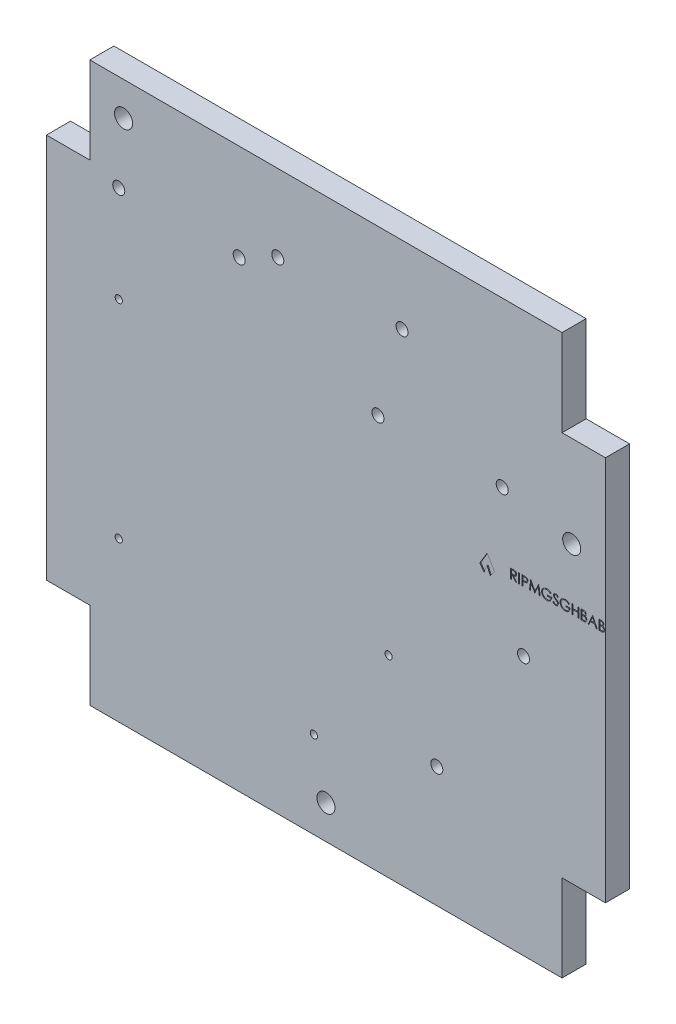
from build123d import *

# Parameters (mm, degrees)
SZKIC2_R                    = 0.75
SZKIC2_R_2                  = 1.875
SZKIC2_R_3                  = 1.25
DODANIE_WYCI_GNI_CIE1_DEPTH = 5
SZKIC4_W                    = 0.179487179
SZKIC4_H                    = 2
WYTNIJ_WYCI_GNI_CIE1_DEPTH  = 0.2


with BuildPart() as part:
    # Szkic2 → Dodanie-wyciągnięcie1 (new body)
    with BuildSketch(Plane.XY):
        Polygon((9, 18), (9, 0), (107, 0), (107, 18), (116, 18), (116, 98), (107, 98), (107, 116), (9, 116), (9, 98), (0, 98), (0, 18), align=None)
        with Locations((55.5, 18)):
            Circle(SZKIC2_R, mode=Mode.SUBTRACT)
        with Locations((15, 33)):
            Circle(SZKIC2_R, mode=Mode.SUBTRACT)
        with Locations((58, 7)):
            Circle(SZKIC2_R_2, mode=Mode.SUBTRACT)
        with Locations((81, 25)):
            Circle(SZKIC2_R_3, mode=Mode.SUBTRACT)
        with Locations((71, 40)):
            Circle(SZKIC2_R, mode=Mode.SUBTRACT)
        with Locations((99, 53.844410204)):
            Circle(SZKIC2_R_3, mode=Mode.SUBTRACT)
        with Locations((15, 76)):
            Circle(SZKIC2_R, mode=Mode.SUBTRACT)
        with Locations((15, 96)):
            Circle(SZKIC2_R_3, mode=Mode.SUBTRACT)
        with Locations((16, 109)):
            Circle(SZKIC2_R_2, mode=Mode.SUBTRACT)
        with Locations((40, 96)):
            Circle(SZKIC2_R_3, mode=Mode.SUBTRACT)
        with Locations((48, 100)):
            Circle(SZKIC2_R_3, mode=Mode.SUBTRACT)
        with Locations((68.790622886, 82)):
            Circle(SZKIC2_R_3, mode=Mode.SUBTRACT)
        with Locations((94.581245773, 82)):
            Circle(SZKIC2_R_3, mode=Mode.SUBTRACT)
        with Locations((109, 79)):
            Circle(SZKIC2_R_2, mode=Mode.SUBTRACT)
        with Locations((73.790622886, 100)):
            Circle(SZKIC2_R_3, mode=Mode.SUBTRACT)
    extrude(amount=DODANIE_WYCI_GNI_CIE1_DEPTH)

    # Szkic4 → Wytnij-wyciągnięcie1 (cut)
    # profile 1 of 12: a face of its own
    with BuildSketch(Plane.XY.offset(5)):
        Polygon((91.452642127, 66.344356395), (90.815929903, 64.844356395), (89.913207368, 66.04230966), (91.452642127, 68.581213421), (92.992076886, 66.04230966), (92.089354351, 64.844356395), align=None)
    # profile 2 of 12: a face of its own
    with BuildSketch(Plane.XY.offset(5)):
        with BuildLine():
            Line((114.666666667, 68.344356395), (115.056891026, 68.344356395))
            add(Edge.make_bspline(
                [(115.056891026, 68.344356395), (115.075993013, 68.344255967), (115.113017419, 68.344061311), (115.1668571, 68.341042378), (115.217284992, 68.336925996), (115.264315719, 68.330394514), (115.307927549, 68.322513499), (115.348251913, 68.312969604), (115.385160583, 68.301525824), (115.429225004, 68.28332795), (115.479465381, 68.256286139), (115.533864463, 68.216326959), (115.580381171, 68.167451266), (115.620487638, 68.11231832), (115.652373992, 68.051669307), (115.675442162, 67.986949771), (115.690046662, 67.91899449), (115.691548625, 67.872341245), (115.692307692, 67.848763447)],
                knots=[0, 0, 0, 0, 1.001505555, 1.941167018, 2.826882275, 3.653841531, 4.429895133, 5.150066043, 5.825578002, 6.45369114, 7.647487171, 8.808567382, 9.977351308, 11.170798116, 12.373658725, 13.556498008, 14.765093433, 16, 16, 16, 16], degree=3))
            add(Edge.make_bspline(
                [(115.692307692, 67.848763447), (115.691682996, 67.826676272), (115.690455409, 67.783272891), (115.678716689, 67.719790543), (115.660339165, 67.659361275), (115.634793308, 67.602205626), (115.601592167, 67.54961499), (115.562244557, 67.501165124), (115.514772098, 67.458907377), (115.479204532, 67.435282861), (115.461137821, 67.423282677)],
                knots=[0, 0, 0, 0, 1.044552857, 2.05264487, 3.044412934, 4.028983338, 5.005914585, 5.980388656, 6.974128949, 8, 8, 8, 8], degree=3))
            add(Edge.make_bspline(
                [(115.461137821, 67.423282677), (115.483858065, 67.414559821), (115.52732752, 67.397870835), (115.587148099, 67.368364856), (115.63868801, 67.336272222), (115.682343522, 67.30122545), (115.719679325, 67.263448987), (115.752281006, 67.222388921), (115.780098934, 67.177509631), (115.803934891, 67.12927904), (115.82253418, 67.078189629), (115.836463268, 67.024720614), (115.844444667, 66.969063726), (115.845580462, 66.931186366), (115.846153846, 66.912064729)],
                knots=[0, 0, 0, 0, 1.27268992, 2.434971085, 3.483601985, 4.442670788, 5.356604649, 6.2567628, 7.179492994, 8.113709626, 9.066344395, 10.018646069, 10.999752585, 12, 12, 12, 12], degree=3))
            add(Edge.make_bspline(
                [(115.846153846, 66.912064729), (115.845595648, 66.892540802), (115.844497379, 66.854126929), (115.836394538, 66.797695423), (115.822675048, 66.743766882), (115.80377725, 66.691992492), (115.77911307, 66.642472415), (115.749097091, 66.59515055), (115.713307626, 66.550502361), (115.673271701, 66.508031719), (115.627979046, 66.469844412), (115.5791129, 66.435835437), (115.52605786, 66.407866259), (115.469685292, 66.384371389), (115.409362826, 66.366424419), (115.345361336, 66.353868662), (115.277736021, 66.345408641), (115.231330449, 66.344713095), (115.207532051, 66.344356395)],
                knots=[0, 0, 0, 0, 0.978564426, 1.925352924, 2.850884081, 3.763762016, 4.682927383, 5.618979971, 6.567305752, 7.547517671, 8.540179244, 9.531824382, 10.526200242, 11.540722885, 12.589160233, 13.674978461, 14.80764778, 16, 16, 16, 16], degree=3))
            Line((115.207532051, 66.344356395), (114.666666667, 66.344356395))
            Line((114.666666667, 66.344356395), (114.666666667, 68.344356395))
        make_face()
        with BuildLine():
            Line((114.846153846, 68.13922819), (114.846153846, 67.498202549))
            Line((114.846153846, 67.498202549), (114.966746795, 67.498202549))
            add(Edge.make_bspline(
                [(114.966746795, 67.498202549), (114.984374678, 67.498431077), (115.01843534, 67.498872638), (115.067760996, 67.500137505), (115.11354672, 67.503679244), (115.155713482, 67.507219965), (115.194194879, 67.512976873), (115.228905657, 67.519829514), (115.260390569, 67.527076889), (115.296698881, 67.53940231), (115.337883423, 67.557618124), (115.381788054, 67.585887745), (115.420493465, 67.619558804), (115.453177572, 67.658410782), (115.479926984, 67.701191459), (115.49850625, 67.747218248), (115.511104698, 67.795344038), (115.512242716, 67.82838304), (115.512820513, 67.845157677)],
                knots=[0, 0, 0, 0, 1.156816544, 2.235205308, 3.236616184, 4.169592532, 5.011045266, 5.787822928, 6.49130361, 7.128639758, 8.301311294, 9.436451833, 10.541879658, 11.654887649, 12.756523258, 13.837046038, 14.901820046, 16, 16, 16, 16], degree=3))
            add(Edge.make_bspline(
                [(115.512820513, 67.845157677), (115.512519838, 67.856258118), (115.511930033, 67.878032845), (115.507099574, 67.909775333), (115.498889532, 67.939628906), (115.488344221, 67.968002683), (115.473607828, 67.994009455), (115.456257277, 68.018548424), (115.435294026, 68.04078392), (115.411432704, 68.061566491), (115.383999205, 68.079991935), (115.353009896, 68.096129514), (115.318045509, 68.109124244), (115.279695306, 68.120504902), (115.23736897, 68.128498213), (115.19155494, 68.135157292), (115.141877957, 68.13854743), (115.107509327, 68.138996209), (115.08974359, 68.13922819)],
                knots=[0, 0, 0, 0, 0.91205012, 1.789085906, 2.630437955, 3.453916878, 4.269457761, 5.079663411, 5.91843418, 6.774407191, 7.675494373, 8.627863946, 9.638891023, 10.736472738, 11.911756761, 13.175263542, 14.539845004, 16, 16, 16, 16], degree=3))
            Line((115.08974359, 68.13922819), (114.846153846, 68.13922819))
        make_face(mode=Mode.SUBTRACT)
        with BuildLine():
            Line((114.846153846, 67.293074344), (114.846153846, 66.5494846))
            Line((114.846153846, 66.5494846), (115.101762821, 66.5494846))
            add(Edge.make_bspline(
                [(115.101762821, 66.5494846), (115.12005935, 66.549703885), (115.155323497, 66.550126526), (115.206238486, 66.551506272), (115.253428831, 66.554644715), (115.296679194, 66.5595852), (115.336456596, 66.564944314), (115.372283855, 66.57215076), (115.404451394, 66.580407309), (115.441750998, 66.593169693), (115.483753003, 66.612996248), (115.529016349, 66.642890092), (115.569259903, 66.678503411), (115.603434337, 66.719721076), (115.631441759, 66.764538977), (115.651816304, 66.812050606), (115.664382508, 66.861470907), (115.665903748, 66.895166171), (115.666666667, 66.912064729)],
                knots=[0, 0, 0, 0, 1.160039823, 2.235823828, 3.228722157, 4.157150951, 4.99529583, 5.772374946, 6.472645482, 7.099169577, 8.269452708, 9.405989375, 10.527446681, 11.663510218, 12.788923519, 13.866172445, 14.929861265, 16, 16, 16, 16], degree=3))
            add(Edge.make_bspline(
                [(115.666666667, 66.912064729), (115.666508893, 66.922632352), (115.66619589, 66.943597141), (115.661475538, 66.974406181), (115.65461047, 67.004249537), (115.645735365, 67.033208246), (115.632809955, 67.060758747), (115.617720501, 67.087445924), (115.600028271, 67.113305055), (115.572460177, 67.145997771), (115.5323619, 67.183664636), (115.475386599, 67.220543208), (115.410602429, 67.250284812), (115.36361529, 67.262913084), (115.339342949, 67.269436524)],
                knots=[0, 0, 0, 0, 0.723448775, 1.435228256, 2.130040452, 2.821711965, 3.505591119, 4.210454504, 4.921174351, 5.648778258, 7.137944449, 8.670945889, 10.280296675, 12, 12, 12, 12], degree=3))
            add(Edge.make_bspline(
                [(115.339342949, 67.269436524), (115.329612037, 67.271410857), (115.308513413, 67.27569162), (115.274109081, 67.280210308), (115.234831442, 67.284236056), (115.190589797, 67.28721386), (115.141328174, 67.290291885), (115.086941363, 67.291488926), (115.027651469, 67.292917075), (114.986512971, 67.29302058), (114.965144231, 67.293074344)],
                knots=[0, 0, 0, 0, 0.634451884, 1.375622551, 2.216452059, 3.157844607, 4.20941857, 5.370758133, 6.634282058, 8, 8, 8, 8], degree=3))
            Line((114.965144231, 67.293074344), (114.846153846, 67.293074344))
        make_face(mode=Mode.SUBTRACT)
    # profile 3 of 12: a face of its own
    with BuildSketch(Plane.XY.offset(5)):
        Polygon((113.384615385, 68.344356395), (114.307692308, 66.344356395), (114.112580128, 66.344356395), (113.816907051, 66.985382036), (112.91025641, 66.985382036), (112.606169872, 66.344356395), (112.41025641, 66.344356395), (113.358974359, 68.344356395), align=None)
        Polygon((113.369791667, 67.954532677), (113.007612179, 67.190510242), (113.722355769, 67.190510242), align=None, mode=Mode.SUBTRACT)
    # profile 4 of 12: a face of its own
    with BuildSketch(Plane.XY.offset(5)):
        with BuildLine():
            Line((110.974358974, 68.344356395), (111.364583333, 68.344356395))
            add(Edge.make_bspline(
                [(111.364583333, 68.344356395), (111.383685321, 68.344255967), (111.420709727, 68.344061311), (111.474549408, 68.341042378), (111.5249773, 68.336925996), (111.572008027, 68.330394514), (111.615619857, 68.322513499), (111.655944221, 68.312969604), (111.692852891, 68.301525824), (111.736917311, 68.28332795), (111.787157689, 68.256286139), (111.841556771, 68.216326959), (111.888073479, 68.167451266), (111.928179946, 68.11231832), (111.9600663, 68.051669307), (111.98313447, 67.986949771), (111.99773897, 67.91899449), (111.999240932, 67.872341245), (112, 67.848763447)],
                knots=[0, 0, 0, 0, 1.001505555, 1.941167018, 2.826882275, 3.653841531, 4.429895133, 5.150066043, 5.825578002, 6.45369114, 7.647487171, 8.808567382, 9.977351308, 11.170798116, 12.373658725, 13.556498008, 14.765093433, 16, 16, 16, 16], degree=3))
            add(Edge.make_bspline(
                [(112, 67.848763447), (111.999375304, 67.826676272), (111.998147717, 67.783272891), (111.986408997, 67.719790543), (111.968031472, 67.659361275), (111.942485616, 67.602205626), (111.909284475, 67.54961499), (111.869936864, 67.501165124), (111.822464406, 67.458907377), (111.78689684, 67.435282861), (111.768830128, 67.423282677)],
                knots=[0, 0, 0, 0, 1.044552857, 2.05264487, 3.044412934, 4.028983338, 5.005914585, 5.980388656, 6.974128949, 8, 8, 8, 8], degree=3))
            add(Edge.make_bspline(
                [(111.768830128, 67.423282677), (111.791550373, 67.414559821), (111.835019828, 67.397870835), (111.894840407, 67.368364856), (111.946380318, 67.336272222), (111.99003583, 67.30122545), (112.027371633, 67.263448987), (112.059973314, 67.222388921), (112.087791242, 67.177509631), (112.111627198, 67.12927904), (112.130226487, 67.078189629), (112.144155576, 67.024720614), (112.152136975, 66.969063726), (112.15327277, 66.931186366), (112.153846154, 66.912064729)],
                knots=[0, 0, 0, 0, 1.27268992, 2.434971085, 3.483601985, 4.442670788, 5.356604649, 6.2567628, 7.179492994, 8.113709626, 9.066344395, 10.018646069, 10.999752585, 12, 12, 12, 12], degree=3))
            add(Edge.make_bspline(
                [(112.153846154, 66.912064729), (112.153287956, 66.892540802), (112.152189686, 66.854126929), (112.144086845, 66.797695423), (112.130367356, 66.743766882), (112.111469558, 66.691992492), (112.086805378, 66.642472415), (112.056789398, 66.59515055), (112.020999933, 66.550502361), (111.980964008, 66.508031719), (111.935671354, 66.469844412), (111.886805208, 66.435835437), (111.833750168, 66.407866259), (111.7773776, 66.384371389), (111.717055134, 66.366424419), (111.653053644, 66.353868662), (111.585428329, 66.345408641), (111.539022757, 66.344713095), (111.515224359, 66.344356395)],
                knots=[0, 0, 0, 0, 0.978564426, 1.925352924, 2.850884081, 3.763762016, 4.682927383, 5.618979971, 6.567305752, 7.547517671, 8.540179244, 9.531824382, 10.526200242, 11.540722885, 12.589160233, 13.674978461, 14.80764778, 16, 16, 16, 16], degree=3))
            Line((111.515224359, 66.344356395), (110.974358974, 66.344356395))
            Line((110.974358974, 66.344356395), (110.974358974, 68.344356395))
        make_face()
        with BuildLine():
            Line((111.153846154, 68.13922819), (111.153846154, 67.498202549))
            Line((111.153846154, 67.498202549), (111.274439103, 67.498202549))
            add(Edge.make_bspline(
                [(111.274439103, 67.498202549), (111.292066986, 67.498431077), (111.326127648, 67.498872638), (111.375453303, 67.500137505), (111.421239028, 67.503679244), (111.46340579, 67.507219965), (111.501887186, 67.512976873), (111.536597964, 67.519829514), (111.568082877, 67.527076889), (111.604391189, 67.53940231), (111.64557573, 67.557618124), (111.689480361, 67.585887745), (111.728185773, 67.619558804), (111.76086988, 67.658410782), (111.787619292, 67.701191459), (111.806198557, 67.747218248), (111.818797006, 67.795344038), (111.819935023, 67.82838304), (111.820512821, 67.845157677)],
                knots=[0, 0, 0, 0, 1.156816544, 2.235205308, 3.236616184, 4.169592532, 5.011045266, 5.787822928, 6.49130361, 7.128639758, 8.301311294, 9.436451833, 10.541879658, 11.654887649, 12.756523258, 13.837046038, 14.901820046, 16, 16, 16, 16], degree=3))
            add(Edge.make_bspline(
                [(111.820512821, 67.845157677), (111.820212146, 67.856258118), (111.81962234, 67.878032845), (111.814791882, 67.909775333), (111.806581839, 67.939628906), (111.796036529, 67.968002683), (111.781300135, 67.994009455), (111.763949585, 68.018548424), (111.742986333, 68.04078392), (111.719125012, 68.061566491), (111.691691513, 68.079991935), (111.660702203, 68.096129514), (111.625737816, 68.109124244), (111.587387614, 68.120504902), (111.545061278, 68.128498213), (111.499247247, 68.135157292), (111.449570265, 68.13854743), (111.415201635, 68.138996209), (111.397435897, 68.13922819)],
                knots=[0, 0, 0, 0, 0.91205012, 1.789085906, 2.630437955, 3.453916878, 4.269457761, 5.079663411, 5.91843418, 6.774407191, 7.675494373, 8.627863946, 9.638891023, 10.736472738, 11.911756761, 13.175263542, 14.539845004, 16, 16, 16, 16], degree=3))
            Line((111.397435897, 68.13922819), (111.153846154, 68.13922819))
        make_face(mode=Mode.SUBTRACT)
        with BuildLine():
            Line((111.153846154, 67.293074344), (111.153846154, 66.5494846))
            Line((111.153846154, 66.5494846), (111.409455128, 66.5494846))
            add(Edge.make_bspline(
                [(111.409455128, 66.5494846), (111.427751657, 66.549703885), (111.463015805, 66.550126526), (111.513930794, 66.551506272), (111.561121139, 66.554644715), (111.604371502, 66.5595852), (111.644148904, 66.564944314), (111.679976162, 66.57215076), (111.712143701, 66.580407309), (111.749443306, 66.593169693), (111.791445311, 66.612996248), (111.836708657, 66.642890092), (111.87695221, 66.678503411), (111.911126644, 66.719721076), (111.939134066, 66.764538977), (111.959508612, 66.812050606), (111.972074816, 66.861470907), (111.973596055, 66.895166171), (111.974358974, 66.912064729)],
                knots=[0, 0, 0, 0, 1.160039823, 2.235823828, 3.228722157, 4.157150951, 4.99529583, 5.772374946, 6.472645482, 7.099169577, 8.269452708, 9.405989375, 10.527446681, 11.663510218, 12.788923519, 13.866172445, 14.929861265, 16, 16, 16, 16], degree=3))
            add(Edge.make_bspline(
                [(111.974358974, 66.912064729), (111.9742012, 66.922632352), (111.973888198, 66.943597141), (111.969167846, 66.974406181), (111.962302778, 67.004249537), (111.953427673, 67.033208246), (111.940502263, 67.060758747), (111.925412809, 67.087445924), (111.907720579, 67.113305055), (111.880152484, 67.145997771), (111.840054207, 67.183664636), (111.783078907, 67.220543208), (111.718294737, 67.250284812), (111.671307598, 67.262913084), (111.647035256, 67.269436524)],
                knots=[0, 0, 0, 0, 0.723448775, 1.435228256, 2.130040452, 2.821711965, 3.505591119, 4.210454504, 4.921174351, 5.648778258, 7.137944449, 8.670945889, 10.280296675, 12, 12, 12, 12], degree=3))
            add(Edge.make_bspline(
                [(111.647035256, 67.269436524), (111.637304344, 67.271410857), (111.61620572, 67.27569162), (111.581801389, 67.280210308), (111.542523749, 67.284236056), (111.498282105, 67.28721386), (111.449020482, 67.290291885), (111.394633671, 67.291488926), (111.335343777, 67.292917075), (111.294205278, 67.29302058), (111.272836538, 67.293074344)],
                knots=[0, 0, 0, 0, 0.634451884, 1.375622551, 2.216452059, 3.157844607, 4.20941857, 5.370758133, 6.634282058, 8, 8, 8, 8], degree=3))
            Line((111.272836538, 67.293074344), (111.153846154, 67.293074344))
        make_face(mode=Mode.SUBTRACT)
    # profile 5 of 12: a face of its own
    with BuildSketch(Plane.XY.offset(5)):
        Polygon((109.076923077, 68.344356395), (109.256410256, 68.344356395), (109.256410256, 67.523843575), (110.282051282, 67.523843575), (110.282051282, 68.344356395), (110.461538462, 68.344356395), (110.461538462, 66.344356395), (110.282051282, 66.344356395), (110.282051282, 67.31871537), (109.256410256, 67.31871537), (109.256410256, 66.344356395), (109.076923077, 66.344356395), align=None)
    # profile 6 of 12: a face of its own
    with BuildSketch(Plane.XY.offset(5)):
        with BuildLine():
            Line((108.538461538, 68.003010242), (108.384615385, 67.857176908))
            add(Edge.make_bspline(
                [(108.384615385, 67.857176908), (108.35677602, 67.883365973), (108.301761136, 67.935119609), (108.212069569, 68.002268749), (108.11849035, 68.059792235), (108.02151178, 68.106595798), (107.923535463, 68.143940233), (107.825861877, 68.170527742), (107.729492905, 68.187483477), (107.665397351, 68.189511117), (107.633814103, 68.190510242)],
                knots=[0, 0, 0, 0, 1.08915593, 2.152340314, 3.188132944, 4.216796309, 5.218260357, 6.173443236, 7.099959455, 8, 8, 8, 8], degree=3))
            add(Edge.make_bspline(
                [(107.633814103, 68.190510242), (107.614434274, 68.190273895), (107.575724879, 68.189801816), (107.518226626, 68.18377655), (107.461331404, 68.175110913), (107.405146619, 68.162572698), (107.349563027, 68.146681806), (107.294773945, 68.126804399), (107.240677171, 68.103629974), (107.187782268, 68.076851417), (107.13650198, 68.047434362), (107.088069503, 68.014835196), (107.042176132, 67.980098745), (106.99968446, 67.942355328), (106.960350068, 67.901946833), (106.923236712, 67.859624944), (106.889649686, 67.814233391), (106.859311878, 67.766607319), (106.832248096, 67.71758321), (106.808357437, 67.667632931), (106.788301958, 67.616922157), (106.772433697, 67.565387255), (106.759341895, 67.513426918), (106.750131834, 67.460681363), (106.744939421, 67.407094115), (106.744041261, 67.371209967), (106.743589744, 67.353170498)],
                knots=[0, 0, 0, 0, 1.02818874, 2.053710826, 3.065248034, 4.081641283, 5.106893873, 6.131558223, 7.173050175, 8.228653731, 9.27666206, 10.308777013, 11.325269123, 12.329503258, 13.32196095, 14.316845687, 15.314881793, 16.315733098, 17.311955233, 18.285320748, 19.252783886, 20.203351036, 21.145449891, 22.095197417, 23.042428769, 24, 24, 24, 24], degree=3))
            add(Edge.make_bspline(
                [(106.743589744, 67.353170498), (106.744021583, 67.334730031), (106.744884081, 67.297899452), (106.750404264, 67.24293141), (106.760648973, 67.188779752), (106.774344806, 67.135266533), (106.791476701, 67.082300105), (106.81283251, 67.0301101), (106.838127139, 66.978698448), (106.867405169, 66.928528381), (106.899511571, 66.879658082), (106.935479046, 66.833624069), (106.973685093, 66.78981334), (107.015521608, 66.749198617), (107.05964706, 66.710693534), (107.10737979, 66.67535895), (107.157781195, 66.642514251), (107.210928174, 66.612573383), (107.266244049, 66.585825648), (107.322962194, 66.562040564), (107.381263803, 66.542452372), (107.440842483, 66.526487741), (107.501627209, 66.513401857), (107.563926525, 66.504983296), (107.627282359, 66.49887425), (107.669990148, 66.498427582), (107.69150641, 66.498202549)],
                knots=[0, 0, 0, 0, 0.93586088, 1.869166235, 2.799637598, 3.729985548, 4.670839027, 5.622275134, 6.589130586, 7.576015415, 8.568469353, 9.55398029, 10.53834874, 11.515998671, 12.510579167, 13.508179873, 14.527009472, 15.561807829, 16.601455013, 17.643573243, 18.680854198, 19.719860599, 20.772568776, 21.833555941, 22.908541556, 24, 24, 24, 24], degree=3))
            add(Edge.make_bspline(
                [(107.69150641, 66.498202549), (107.717436894, 66.498744593), (107.768355613, 66.499808983), (107.843205009, 66.508094863), (107.915092478, 66.521035888), (107.983816022, 66.539987829), (108.049455463, 66.564161358), (108.112251429, 66.593301578), (108.17170952, 66.628526184), (108.228008476, 66.668282679), (108.279869725, 66.712576869), (108.32664351, 66.760373701), (108.36758379, 66.811441167), (108.403300761, 66.86547849), (108.432848563, 66.92293295), (108.457101589, 66.983522986), (108.475692041, 67.04727585), (108.483323456, 67.091328211), (108.487179487, 67.113587165)],
                knots=[0, 0, 0, 0, 1.13008108, 2.219097802, 3.278683437, 4.311054135, 5.322181354, 6.324827112, 7.324222904, 8.330512327, 9.32562643, 10.293043162, 11.24128371, 12.174520618, 13.111833804, 14.052305215, 15.015860969, 16, 16, 16, 16], degree=3))
            Line((108.487179487, 67.113587165), (107.820512821, 67.113587165))
            Line((107.820512821, 67.113587165), (107.820512821, 67.31871537))
            Line((107.820512821, 67.31871537), (108.666666667, 67.31871537))
            add(Edge.make_bspline(
                [(108.666666667, 67.31871537), (108.665691896, 67.280482519), (108.663784094, 67.205653924), (108.650401857, 67.096528055), (108.628792421, 66.993458516), (108.599272243, 66.89633676), (108.561057797, 66.805300422), (108.514559209, 66.72025707), (108.459032283, 66.641756109), (108.396454888, 66.569156678), (108.326226341, 66.504397129), (108.250244272, 66.44747945), (108.168383147, 66.399535098), (108.0807204, 66.360529005), (107.98754301, 66.330086723), (107.888635364, 66.308502964), (107.784131592, 66.295571557), (107.712510634, 66.29391934), (107.67588141, 66.293074344)],
                knots=[0, 0, 0, 0, 1.140356446, 2.231883559, 3.274166699, 4.278491846, 5.25512956, 6.21435461, 7.1637429, 8.11826594, 9.068280886, 10.0076534, 10.945064095, 11.891975133, 12.864533718, 13.863980011, 14.907571808, 16, 16, 16, 16], degree=3))
            add(Edge.make_bspline(
                [(107.67588141, 66.293074344), (107.65330419, 66.293399556), (107.608774635, 66.294040979), (107.543008391, 66.298599464), (107.479055465, 66.305616936), (107.416925174, 66.316214149), (107.356388978, 66.329193952), (107.297749215, 66.345814934), (107.240782506, 66.36505419), (107.1854008, 66.386937432), (107.132106773, 66.412292665), (107.080663049, 66.440469602), (107.030785263, 66.471322951), (106.982813169, 66.505386291), (106.936496813, 66.54240484), (106.892134846, 66.582452793), (106.849478915, 66.625407719), (106.82275865, 66.65591001), (106.809294872, 66.671279472)],
                knots=[0, 0, 0, 0, 1.107784379, 2.184907829, 3.233506516, 4.263428166, 5.276301166, 6.270063455, 7.25232949, 8.225834625, 9.190232166, 10.146266622, 11.1027726, 12.066435141, 13.031522626, 14.010570082, 14.99756817, 16, 16, 16, 16], degree=3))
            add(Edge.make_bspline(
                [(106.809294872, 66.671279472), (106.789760054, 66.695662703), (106.751014675, 66.744024427), (106.701141443, 66.821510109), (106.658626355, 66.901739744), (106.624130457, 66.984936674), (106.597194408, 67.071023081), (106.577876549, 67.159888962), (106.566558098, 67.251648751), (106.564927505, 67.313743188), (106.564102564, 67.345157677)],
                knots=[0, 0, 0, 0, 1.023165419, 2.029347347, 3.013907458, 3.994755782, 4.975994455, 5.96558838, 6.970761222, 8, 8, 8, 8], degree=3))
            add(Edge.make_bspline(
                [(106.564102564, 67.345157677), (106.5644067, 67.36868125), (106.565011107, 67.415429426), (106.572339973, 67.484833602), (106.582855069, 67.553005426), (106.598310529, 67.619889172), (106.617794109, 67.68552951), (106.642110387, 67.749956918), (106.670421756, 67.813209416), (106.703327754, 67.874851627), (106.739947445, 67.934065577), (106.779690428, 67.990612893), (106.823121056, 68.043463787), (106.869530085, 68.093287586), (106.919471222, 68.139458356), (106.972476607, 68.182403562), (107.028587089, 68.222180811), (107.087979191, 68.258163574), (107.14976644, 68.290485643), (107.213800726, 68.318822335), (107.280062504, 68.342241373), (107.348055348, 68.362112104), (107.41829392, 68.37680647), (107.490268513, 68.387462896), (107.564354291, 68.394754667), (107.614432022, 68.395341099), (107.639823718, 68.395638447)],
                knots=[0, 0, 0, 0, 1.008945113, 2.00506715, 2.99143336, 3.967273523, 4.948097931, 5.927297278, 6.919902385, 7.919676788, 8.923139349, 9.905703106, 10.883022732, 11.856032218, 12.825136022, 13.798837087, 14.781400844, 15.773989409, 16.776158564, 17.77167057, 18.775803737, 19.789618931, 20.80898985, 21.851988756, 22.910860228, 24, 24, 24, 24], degree=3))
            add(Edge.make_bspline(
                [(107.639823718, 68.395638447), (107.660531286, 68.395307308), (107.701591959, 68.3946507), (107.762692378, 68.390099473), (107.822848386, 68.382885827), (107.88214918, 68.373041949), (107.940392818, 68.359634125), (107.997745221, 68.343589391), (108.054289528, 68.32490835), (108.109848527, 68.302629009), (108.164795794, 68.277341223), (108.219436845, 68.248876411), (108.273584986, 68.216747837), (108.327334118, 68.180860102), (108.38102318, 68.141829578), (108.433802975, 68.098539964), (108.486947515, 68.052698389), (108.52111998, 68.019737141), (108.538461538, 68.003010242)],
                knots=[0, 0, 0, 0, 0.985871117, 1.954866573, 2.915460327, 3.869826059, 4.81536089, 5.759505086, 6.70452669, 7.649098992, 8.607881297, 9.583363685, 10.581137262, 11.603961102, 12.659522466, 13.73993555, 14.853081303, 16, 16, 16, 16], degree=3))
        make_face()
    # profile 7 of 12: a face of its own
    with BuildSketch(Plane.XY.offset(5)):
        with BuildLine():
            Line((105.076923077, 66.730173703), (105.24599359, 66.831535883))
            add(Edge.make_bspline(
                [(105.24599359, 66.831535883), (105.261718297, 66.805213377), (105.291846229, 66.754780472), (105.342104148, 66.68663302), (105.394180097, 66.628711788), (105.448459716, 66.581353726), (105.504611687, 66.544068648), (105.563002575, 66.517667373), (105.623435609, 66.501201101), (105.664563507, 66.499201052), (105.685096154, 66.498202549)],
                knots=[0, 0, 0, 0, 1.272034388, 2.437168799, 3.508375237, 4.49857839, 5.41946034, 6.295179144, 7.148887113, 8, 8, 8, 8], degree=3))
            add(Edge.make_bspline(
                [(105.685096154, 66.498202549), (105.702631503, 66.498690933), (105.737395373, 66.499659156), (105.788573798, 66.508962472), (105.838277685, 66.523255117), (105.88548262, 66.543724221), (105.929537257, 66.56848907), (105.968169655, 66.598401171), (106.001567434, 66.631890432), (106.028886928, 66.669251949), (106.049846948, 66.709433176), (106.065956701, 66.750676577), (106.074896743, 66.793630045), (106.07624346, 66.822550309), (106.076923077, 66.837144857)],
                knots=[0, 0, 0, 0, 1.095163259, 2.171163733, 3.241058638, 4.321873601, 5.38011039, 6.391990106, 7.366004449, 8.327778327, 9.272591725, 10.192022065, 11.087607919, 12, 12, 12, 12], degree=3))
            add(Edge.make_bspline(
                [(106.076923077, 66.837144857), (106.076080614, 66.853796771), (106.074368009, 66.887647679), (106.059892878, 66.937590338), (106.037121879, 66.987014664), (106.016114654, 67.017586815), (106.005208333, 67.033458959)],
                knots=[0, 0, 0, 0, 0.938893495, 1.908633276, 2.914225137, 4, 4, 4, 4], degree=3))
            add(Edge.make_bspline(
                [(106.005208333, 67.033458959), (105.996253697, 67.044914287), (105.977454557, 67.068963315), (105.945135978, 67.104760592), (105.907212485, 67.141685403), (105.864981882, 67.181147721), (105.816905831, 67.221312177), (105.764490108, 67.26409405), (105.706396475, 67.30786638), (105.665653905, 67.337222131), (105.64463141, 67.352369216)],
                knots=[0, 0, 0, 0, 0.722233717, 1.516239348, 2.393582979, 3.351407094, 4.387010283, 5.505090956, 6.712668013, 8, 8, 8, 8], degree=3))
            add(Edge.make_bspline(
                [(105.64463141, 67.352369216), (105.623589127, 67.36735698), (105.583357883, 67.396012444), (105.527095836, 67.438540607), (105.476784714, 67.477422818), (105.432648133, 67.51302511), (105.394705507, 67.545352313), (105.362657843, 67.574093993), (105.337321525, 67.600027456), (105.323232622, 67.61685108), (105.316907051, 67.624404472)],
                knots=[0, 0, 0, 0, 1.452282411, 2.77665338, 3.964542531, 5.026858415, 5.96415736, 6.766646006, 7.446254459, 8, 8, 8, 8], degree=3))
            add(Edge.make_bspline(
                [(105.316907051, 67.624404472), (105.308065597, 67.636176493), (105.29067769, 67.659327753), (105.267725687, 67.695513386), (105.248217594, 67.732555252), (105.232924833, 67.770552888), (105.220046993, 67.808972848), (105.211385319, 67.848316417), (105.205961663, 67.888407056), (105.205406243, 67.915386199), (105.205128205, 67.928891652)],
                knots=[0, 0, 0, 0, 1.068054152, 2.10047183, 3.106115577, 4.101338837, 5.06977816, 6.043150881, 7.020423561, 8, 8, 8, 8], degree=3))
            add(Edge.make_bspline(
                [(105.205128205, 67.928891652), (105.205874039, 67.950051523), (105.207349765, 67.991918988), (105.21983006, 68.053079462), (105.239528857, 68.111471701), (105.267125935, 68.166517606), (105.302701566, 68.216783881), (105.343870694, 68.26284873), (105.392905829, 68.301573634), (105.446707328, 68.335409096), (105.505596683, 68.361892482), (105.567305771, 68.381870185), (105.631932669, 68.393189761), (105.675705889, 68.394814198), (105.697916667, 68.395638447)],
                knots=[0, 0, 0, 0, 1.005424448, 1.989358655, 2.955360095, 3.929531133, 4.905563448, 5.876582895, 6.856512386, 7.866279853, 8.892233794, 9.918561126, 10.94386622, 12, 12, 12, 12], degree=3))
            add(Edge.make_bspline(
                [(105.697916667, 68.395638447), (105.721484724, 68.39482556), (105.768354068, 68.393208988), (105.837296477, 68.379153256), (105.903674029, 68.355895729), (105.95707018, 68.32950221), (105.99886033, 68.303141401), (106.030730463, 68.279130073), (106.063026149, 68.251487154), (106.096007894, 68.220139013), (106.129116843, 68.184798013), (106.16284453, 68.14570619), (106.197269826, 68.103102444), (106.219416032, 68.072688444), (106.230769231, 68.05709678)],
                knots=[0, 0, 0, 0, 1.286793592, 2.559021753, 3.825965368, 5.121522368, 5.803751409, 6.523245864, 7.299691795, 8.125521123, 9.008227632, 9.944561021, 10.946284179, 12, 12, 12, 12], degree=3))
            Line((106.230769231, 68.05709678), (106.068509615, 67.934099985))
            add(Edge.make_bspline(
                [(106.068509615, 67.934099985), (106.05871194, 67.946722094), (106.039843907, 67.971029324), (106.011198486, 68.005070076), (105.984199259, 68.036165207), (105.95759903, 68.063173852), (105.932802669, 68.087575071), (105.908735788, 68.108466361), (105.88574473, 68.126052415), (105.856763638, 68.144820164), (105.820353514, 68.16342388), (105.774648064, 68.17916621), (105.726884479, 68.188626246), (105.694353261, 68.189877039), (105.677884615, 68.190510242)],
                knots=[0, 0, 0, 0, 1.181633172, 2.275549214, 3.290209073, 4.226197932, 5.078386478, 5.862611352, 6.581680152, 7.217281963, 8.414376989, 9.595101626, 10.782541182, 12, 12, 12, 12], degree=3))
            add(Edge.make_bspline(
                [(105.677884615, 68.190510242), (105.657223745, 68.189817842), (105.617381204, 68.188482613), (105.560815355, 68.173899765), (105.509904541, 68.150938702), (105.466160218, 68.118758714), (105.429739088, 68.080632433), (105.403393111, 68.036758801), (105.387535875, 67.988311714), (105.385600858, 67.954516482), (105.384615385, 67.937305113)],
                knots=[0, 0, 0, 0, 1.14458467, 2.207223713, 3.21896685, 4.227309161, 5.202851033, 6.127160689, 7.046193047, 8, 8, 8, 8], degree=3))
            add(Edge.make_bspline(
                [(105.384615385, 67.937305113), (105.384840028, 67.926589983), (105.385289683, 67.9051422), (105.391560996, 67.873455673), (105.399617756, 67.841849194), (105.412384974, 67.810464861), (105.430010862, 67.778753798), (105.453156676, 67.746169948), (105.48230714, 67.712426115), (105.504636862, 67.690479044), (105.516426282, 67.678891652)],
                knots=[0, 0, 0, 0, 0.858281714, 1.717966888, 2.583508476, 3.4729293, 4.427298488, 5.488583878, 6.674047936, 8, 8, 8, 8], degree=3))
            add(Edge.make_bspline(
                [(105.516426282, 67.678891652), (105.520804209, 67.67498478), (105.531205162, 67.665702947), (105.550219976, 67.650507358), (105.575330147, 67.631762916), (105.605879976, 67.608570164), (105.642432754, 67.581666471), (105.684992501, 67.551395836), (105.733084805, 67.516775574), (105.767211614, 67.492571265), (105.78525641, 67.479773062)],
                knots=[0, 0, 0, 0, 0.420754252, 0.999615792, 1.744751191, 2.668019286, 3.750313428, 4.999500688, 6.413464383, 8, 8, 8, 8], degree=3))
            add(Edge.make_bspline(
                [(105.78525641, 67.479773062), (105.806962646, 67.463977999), (105.848993764, 67.43339305), (105.908798096, 67.387441233), (105.963023129, 67.342499651), (106.011859245, 67.298855304), (106.055788907, 67.256839251), (106.094324748, 67.215946005), (106.127859422, 67.176468535), (106.163961833, 67.125855634), (106.200852015, 67.063695015), (106.232532877, 66.987536021), (106.252509075, 66.911080981), (106.25512137, 66.859694217), (106.256410256, 66.83434037)],
                knots=[0, 0, 0, 0, 1.163667725, 2.253281268, 3.268753668, 4.215851969, 5.092017293, 5.902905408, 6.650798638, 7.335211899, 8.59617414, 9.77448103, 10.901945474, 12, 12, 12, 12], degree=3))
            add(Edge.make_bspline(
                [(106.256410256, 66.83434037), (106.256034749, 66.816409875), (106.255291026, 66.780897085), (106.246741932, 66.728751327), (106.234216409, 66.678105115), (106.21533799, 66.62958448), (106.192296185, 66.582301758), (106.163058329, 66.537497244), (106.129168224, 66.494179302), (106.090291787, 66.453503021), (106.047751271, 66.416162337), (106.00278916, 66.382945731), (105.955331861, 66.355249546), (105.905636823, 66.332649065), (105.853692631, 66.314972769), (105.799516754, 66.302165415), (105.743019891, 66.294305009), (105.704619615, 66.293489145), (105.685096154, 66.293074344)],
                knots=[0, 0, 0, 0, 0.983748083, 1.948392443, 2.894712957, 3.844097841, 4.80183111, 5.778335162, 6.776009319, 7.81870978, 8.863265674, 9.881300176, 10.883814829, 11.87499822, 12.874611388, 13.892143829, 14.928324115, 16, 16, 16, 16], degree=3))
            add(Edge.make_bspline(
                [(105.685096154, 66.293074344), (105.669990244, 66.293366448), (105.639968666, 66.293946977), (105.595563248, 66.299079137), (105.552054911, 66.306340339), (105.509989607, 66.317868379), (105.468825372, 66.331855223), (105.428741238, 66.349077127), (105.389717779, 66.369715528), (105.351536303, 66.393312685), (105.314293917, 66.420774253), (105.278339936, 66.452759108), (105.242494687, 66.488385111), (105.207816175, 66.528619719), (105.173602949, 66.572812909), (105.140529573, 66.621378157), (105.107911448, 66.67405093), (105.087445467, 66.711116694), (105.076923077, 66.730173703)],
                knots=[0, 0, 0, 0, 0.915332311, 1.819136955, 2.706846663, 3.586547465, 4.459518054, 5.340707479, 6.227863349, 7.133153174, 8.059268498, 9.028702269, 10.047606654, 11.120612155, 12.245963614, 13.433783089, 14.680604001, 16, 16, 16, 16], degree=3))
        make_face()
    # profile 8 of 12: a face of its own
    with BuildSketch(Plane.XY.offset(5)):
        with BuildLine():
            Line((104.743589744, 68.003010242), (104.58974359, 67.857176908))
            add(Edge.make_bspline(
                [(104.58974359, 67.857176908), (104.561904225, 67.883365973), (104.506889341, 67.935119609), (104.417197774, 68.002268749), (104.323618555, 68.059792235), (104.226639985, 68.106595798), (104.128663669, 68.143940233), (104.030990082, 68.170527742), (103.93462111, 68.187483477), (103.870525557, 68.189511117), (103.838942308, 68.190510242)],
                knots=[0, 0, 0, 0, 1.08915593, 2.152340314, 3.188132944, 4.216796309, 5.218260357, 6.173443236, 7.099959455, 8, 8, 8, 8], degree=3))
            add(Edge.make_bspline(
                [(103.838942308, 68.190510242), (103.819562479, 68.190273895), (103.780853085, 68.189801816), (103.723354831, 68.18377655), (103.66645961, 68.175110913), (103.610274824, 68.162572698), (103.554691232, 68.146681806), (103.499902151, 68.126804399), (103.445805376, 68.103629974), (103.392910473, 68.076851417), (103.341630185, 68.047434362), (103.293197708, 68.014835196), (103.247304337, 67.980098745), (103.204812665, 67.942355328), (103.165478273, 67.901946833), (103.128364918, 67.859624944), (103.094777891, 67.814233391), (103.064440083, 67.766607319), (103.037376301, 67.71758321), (103.013485642, 67.667632931), (102.993430163, 67.616922157), (102.977561903, 67.565387255), (102.9644701, 67.513426918), (102.955260039, 67.460681363), (102.950067626, 67.407094115), (102.949169466, 67.371209967), (102.948717949, 67.353170498)],
                knots=[0, 0, 0, 0, 1.02818874, 2.053710826, 3.065248034, 4.081641283, 5.106893873, 6.131558223, 7.173050175, 8.228653731, 9.27666206, 10.308777013, 11.325269123, 12.329503258, 13.32196095, 14.316845687, 15.314881793, 16.315733098, 17.311955233, 18.285320748, 19.252783886, 20.203351036, 21.145449891, 22.095197417, 23.042428769, 24, 24, 24, 24], degree=3))
            add(Edge.make_bspline(
                [(102.948717949, 67.353170498), (102.949149788, 67.334730031), (102.950012287, 67.297899452), (102.955532469, 67.24293141), (102.965777178, 67.188779752), (102.979473012, 67.135266533), (102.996604906, 67.082300105), (103.017960715, 67.0301101), (103.043255344, 66.978698448), (103.072533374, 66.928528381), (103.104639776, 66.879658082), (103.140607251, 66.833624069), (103.178813299, 66.78981334), (103.220649813, 66.749198617), (103.264775265, 66.710693534), (103.312507995, 66.67535895), (103.362909401, 66.642514251), (103.416056379, 66.612573383), (103.471372255, 66.585825648), (103.528090399, 66.562040564), (103.586392008, 66.542452372), (103.645970688, 66.526487741), (103.706755415, 66.513401857), (103.76905473, 66.504983296), (103.832410564, 66.49887425), (103.875118353, 66.498427582), (103.896634615, 66.498202549)],
                knots=[0, 0, 0, 0, 0.93586088, 1.869166235, 2.799637598, 3.729985548, 4.670839027, 5.622275134, 6.589130586, 7.576015415, 8.568469353, 9.55398029, 10.53834874, 11.515998671, 12.510579167, 13.508179873, 14.527009472, 15.561807829, 16.601455013, 17.643573243, 18.680854198, 19.719860599, 20.772568776, 21.833555941, 22.908541556, 24, 24, 24, 24], degree=3))
            add(Edge.make_bspline(
                [(103.896634615, 66.498202549), (103.9225651, 66.498744593), (103.973483818, 66.499808983), (104.048333214, 66.508094863), (104.120220683, 66.521035888), (104.188944227, 66.539987829), (104.254583668, 66.564161358), (104.317379634, 66.593301578), (104.376837725, 66.628526184), (104.433136681, 66.668282679), (104.48499793, 66.712576869), (104.531771715, 66.760373701), (104.572711995, 66.811441167), (104.608428966, 66.86547849), (104.637976768, 66.92293295), (104.662229794, 66.983522986), (104.680820247, 67.04727585), (104.688451661, 67.091328211), (104.692307692, 67.113587165)],
                knots=[0, 0, 0, 0, 1.13008108, 2.219097802, 3.278683437, 4.311054135, 5.322181354, 6.324827112, 7.324222904, 8.330512327, 9.32562643, 10.293043162, 11.24128371, 12.174520618, 13.111833804, 14.052305215, 15.015860969, 16, 16, 16, 16], degree=3))
            Line((104.692307692, 67.113587165), (104.025641026, 67.113587165))
            Line((104.025641026, 67.113587165), (104.025641026, 67.31871537))
            Line((104.025641026, 67.31871537), (104.871794872, 67.31871537))
            add(Edge.make_bspline(
                [(104.871794872, 67.31871537), (104.870820101, 67.280482519), (104.868912299, 67.205653924), (104.855530062, 67.096528055), (104.833920626, 66.993458516), (104.804400448, 66.89633676), (104.766186002, 66.805300422), (104.719687414, 66.72025707), (104.664160488, 66.641756109), (104.601583093, 66.569156678), (104.531354546, 66.504397129), (104.455372477, 66.44747945), (104.373511352, 66.399535098), (104.285848605, 66.360529005), (104.192671215, 66.330086723), (104.093763569, 66.308502964), (103.989259797, 66.295571557), (103.917638839, 66.29391934), (103.881009615, 66.293074344)],
                knots=[0, 0, 0, 0, 1.140356446, 2.231883559, 3.274166699, 4.278491846, 5.25512956, 6.21435461, 7.1637429, 8.11826594, 9.068280886, 10.0076534, 10.945064095, 11.891975133, 12.864533718, 13.863980011, 14.907571808, 16, 16, 16, 16], degree=3))
            add(Edge.make_bspline(
                [(103.881009615, 66.293074344), (103.858432395, 66.293399556), (103.81390284, 66.294040979), (103.748136596, 66.298599464), (103.68418367, 66.305616936), (103.622053379, 66.316214149), (103.561517183, 66.329193952), (103.502877421, 66.345814934), (103.445910711, 66.36505419), (103.390529005, 66.386937432), (103.337234978, 66.412292665), (103.285791254, 66.440469602), (103.235913468, 66.471322951), (103.187941374, 66.505386291), (103.141625019, 66.54240484), (103.097263051, 66.582452793), (103.05460712, 66.625407719), (103.027886856, 66.65591001), (103.014423077, 66.671279472)],
                knots=[0, 0, 0, 0, 1.107784379, 2.184907829, 3.233506516, 4.263428166, 5.276301166, 6.270063455, 7.25232949, 8.225834625, 9.190232166, 10.146266622, 11.1027726, 12.066435141, 13.031522626, 14.010570082, 14.99756817, 16, 16, 16, 16], degree=3))
            add(Edge.make_bspline(
                [(103.014423077, 66.671279472), (102.994888259, 66.695662703), (102.95614288, 66.744024427), (102.906269648, 66.821510109), (102.86375456, 66.901739744), (102.829258662, 66.984936674), (102.802322613, 67.071023081), (102.783004754, 67.159888962), (102.771686303, 67.251648751), (102.77005571, 67.313743188), (102.769230769, 67.345157677)],
                knots=[0, 0, 0, 0, 1.023165419, 2.029347347, 3.013907458, 3.994755782, 4.975994455, 5.96558838, 6.970761222, 8, 8, 8, 8], degree=3))
            add(Edge.make_bspline(
                [(102.769230769, 67.345157677), (102.769534905, 67.36868125), (102.770139312, 67.415429426), (102.777468178, 67.484833602), (102.787983274, 67.553005426), (102.803438734, 67.619889172), (102.822922314, 67.68552951), (102.847238592, 67.749956918), (102.875549961, 67.813209416), (102.908455959, 67.874851627), (102.94507565, 67.934065577), (102.984818633, 67.990612893), (103.028249262, 68.043463787), (103.07465829, 68.093287586), (103.124599427, 68.139458356), (103.177604812, 68.182403562), (103.233715294, 68.222180811), (103.293107397, 68.258163574), (103.354894645, 68.290485643), (103.418928931, 68.318822335), (103.485190709, 68.342241373), (103.553183553, 68.362112104), (103.623422125, 68.37680647), (103.695396718, 68.387462896), (103.769482496, 68.394754667), (103.819560227, 68.395341099), (103.844951923, 68.395638447)],
                knots=[0, 0, 0, 0, 1.008945113, 2.00506715, 2.99143336, 3.967273523, 4.948097931, 5.927297278, 6.919902385, 7.919676788, 8.923139349, 9.905703106, 10.883022732, 11.856032218, 12.825136022, 13.798837087, 14.781400844, 15.773989409, 16.776158564, 17.77167057, 18.775803737, 19.789618931, 20.80898985, 21.851988756, 22.910860228, 24, 24, 24, 24], degree=3))
            add(Edge.make_bspline(
                [(103.844951923, 68.395638447), (103.865659491, 68.395307308), (103.906720164, 68.3946507), (103.967820583, 68.390099473), (104.027976591, 68.382885827), (104.087277385, 68.373041949), (104.145521023, 68.359634125), (104.202873426, 68.343589391), (104.259417733, 68.32490835), (104.314976732, 68.302629009), (104.369923999, 68.277341223), (104.42456505, 68.248876411), (104.478713191, 68.216747837), (104.532462323, 68.180860102), (104.586151385, 68.141829578), (104.63893118, 68.098539964), (104.69207572, 68.052698389), (104.726248185, 68.019737141), (104.743589744, 68.003010242)],
                knots=[0, 0, 0, 0, 0.985871117, 1.954866573, 2.915460327, 3.869826059, 4.81536089, 5.759505086, 6.70452669, 7.649098992, 8.607881297, 9.583363685, 10.581137262, 11.603961102, 12.659522466, 13.73993555, 14.853081303, 16, 16, 16, 16], degree=3))
        make_face()
    # profile 9 of 12: a face of its own
    with BuildSketch(Plane.XY.offset(5)):
        Polygon((100.230769231, 66.344356395), (100.494791667, 68.344356395), (100.520432692, 68.344356395), (101.346153846, 66.703330754), (102.169871795, 68.344356395), (102.195913462, 68.344356395), (102.461538462, 66.344356395), (102.28125, 66.344356395), (102.08974359, 67.783458959), (101.367788462, 66.344356395), (101.327323718, 66.344356395), (100.602564103, 67.786664088), (100.411458333, 66.344356395), align=None)
    # profile 10 of 12: a face of its own
    with BuildSketch(Plane.XY.offset(5)):
        with BuildLine():
            Line((98.692307692, 68.344356395), (99.084535256, 68.344356395))
            add(Edge.make_bspline(
                [(99.084535256, 68.344356395), (99.111512917, 68.34432674), (99.163203313, 68.34426992), (99.237326202, 68.342547208), (99.304646049, 68.340246241), (99.365017695, 68.337056588), (99.418626894, 68.333287108), (99.465231065, 68.328000228), (99.505196526, 68.322480059), (99.529143068, 68.316867827), (99.540064103, 68.314308318)],
                knots=[0, 0, 0, 0, 1.415646017, 2.712440637, 3.8905458, 4.950247383, 5.884950622, 6.709939814, 7.411656543, 8, 8, 8, 8], degree=3))
            add(Edge.make_bspline(
                [(99.540064103, 68.314308318), (99.553888979, 68.310524347), (99.581212966, 68.303045569), (99.620584991, 68.288066298), (99.658044331, 68.270305061), (99.693719507, 68.25006281), (99.727172126, 68.226471059), (99.758901292, 68.200486134), (99.788626995, 68.171508095), (99.816182076, 68.139861958), (99.841487675, 68.106078981), (99.863276065, 68.06965485), (99.881520195, 68.031202676), (99.897167779, 67.990749207), (99.908429753, 67.947954737), (99.916913695, 67.903116615), (99.922298625, 67.856239649), (99.922814375, 67.824205439), (99.923076923, 67.807898062)],
                knots=[0, 0, 0, 0, 0.999701418, 1.975846123, 2.934577507, 3.890451536, 4.834027766, 5.787354733, 6.749476667, 7.726910423, 8.712836071, 9.690891519, 10.682875813, 11.679750201, 12.712814741, 13.765529915, 14.8625177, 16, 16, 16, 16], degree=3))
            add(Edge.make_bspline(
                [(99.923076923, 67.807898062), (99.922836109, 67.791453618), (99.92236494, 67.759278953), (99.91670992, 67.712208788), (99.909092667, 67.667226851), (99.897380066, 67.624432879), (99.882039681, 67.584081011), (99.864044223, 67.545554592), (99.842339348, 67.509509065), (99.817399445, 67.47581357), (99.789655677, 67.444436477), (99.759225427, 67.415605166), (99.726231545, 67.389488401), (99.690778889, 67.366027633), (99.652521833, 67.345766902), (99.612040602, 67.327619871), (99.568983336, 67.312379265), (99.539187613, 67.304362087), (99.524038462, 67.300285883)],
                knots=[0, 0, 0, 0, 1.121902311, 2.195077645, 3.232258892, 4.234102512, 5.217864754, 6.176164875, 7.132989551, 8.084763148, 9.034132444, 9.988522005, 10.94243251, 11.903244335, 12.886203696, 13.894208494, 14.929344452, 16, 16, 16, 16], degree=3))
            add(Edge.make_bspline(
                [(99.524038462, 67.300285883), (99.511508556, 67.297621322), (99.484048541, 67.291781782), (99.438824128, 67.285262664), (99.386169622, 67.279698321), (99.32615689, 67.275526242), (99.258839802, 67.271954603), (99.184181941, 67.269115692), (99.102036754, 67.267555776), (99.0447389, 67.267475323), (99.014823718, 67.267433318)],
                knots=[0, 0, 0, 0, 0.601384939, 1.31797006, 2.144135048, 3.087295005, 4.142315834, 5.309527816, 6.595305764, 8, 8, 8, 8], degree=3))
            Line((99.014823718, 67.267433318), (98.871794872, 67.267433318))
            Line((98.871794872, 67.267433318), (98.871794872, 66.344356395))
            Line((98.871794872, 66.344356395), (98.692307692, 66.344356395))
            Line((98.692307692, 66.344356395), (98.692307692, 68.344356395))
        make_face()
        with BuildLine():
            Line((98.871794872, 68.13922819), (98.871794872, 67.472561524))
            Line((98.871794872, 67.472561524), (99.221955128, 67.468154472))
            add(Edge.make_bspline(
                [(99.221955128, 67.468154472), (99.239052229, 67.468145636), (99.272057829, 67.468128578), (99.31973567, 67.470405848), (99.363969549, 67.473034724), (99.404623592, 67.476883823), (99.441716126, 67.482324542), (99.475309, 67.487816963), (99.505141733, 67.495762885), (99.540055562, 67.506461781), (99.578960332, 67.52470899), (99.621284646, 67.551194642), (99.657153552, 67.584955047), (99.688192579, 67.622913807), (99.712824509, 67.665141881), (99.730856505, 67.710324131), (99.741451452, 67.757997188), (99.742872134, 67.790618981), (99.743589744, 67.80709678)],
                knots=[0, 0, 0, 0, 1.160613943, 2.240541288, 3.23993089, 4.169200891, 5.011653406, 5.7853311, 6.478053781, 7.106038997, 8.262395093, 9.384106736, 10.481365981, 11.59014053, 12.70357646, 13.786202915, 14.881775077, 16, 16, 16, 16], degree=3))
            add(Edge.make_bspline(
                [(99.743589744, 67.80709678), (99.742868231, 67.823175931), (99.741433954, 67.855139292), (99.730773461, 67.901984298), (99.712859567, 67.946690415), (99.688027228, 67.988389321), (99.657889439, 68.026211494), (99.622861243, 68.059066995), (99.583025094, 68.085479397), (99.545968962, 68.102526986), (99.513053998, 68.112935715), (99.484464307, 68.120218481), (99.452183921, 68.126033113), (99.416202333, 68.130741401), (99.376798428, 68.13477195), (99.333633677, 68.137506794), (99.286871595, 68.139107626), (99.254408411, 68.139187029), (99.237580128, 68.13922819)],
                knots=[0, 0, 0, 0, 1.120700087, 2.227813068, 3.331159281, 4.466773991, 5.599788987, 6.693661531, 7.80175334, 8.91857717, 9.525282508, 10.207424825, 10.974604443, 11.810962634, 12.737642355, 13.736264703, 14.826523623, 16, 16, 16, 16], degree=3))
            Line((99.237580128, 68.13922819), (98.871794872, 68.13922819))
        make_face(mode=Mode.SUBTRACT)
    # profile 11 of 12: a face of its own
    with BuildSketch(Plane.XY.offset(5)):
        with Locations((98.08974359, 67.344356395)):
            Rectangle(SZKIC4_W, SZKIC4_H)
    # profile 12 of 12: a face of its own
    with BuildSketch(Plane.XY.offset(5)):
        with BuildLine():
            Line((96.307692308, 68.344356395), (96.707932692, 68.344356395))
            add(Edge.make_bspline(
                [(96.707932692, 68.344356395), (96.734641909, 68.344267489), (96.785926563, 68.344096779), (96.859397003, 68.343144915), (96.926155344, 68.340416711), (96.986166681, 68.338068949), (97.039429912, 68.33378784), (97.086108364, 68.329696042), (97.125987048, 68.324339664), (97.150127535, 68.319365137), (97.161057692, 68.317112806)],
                knots=[0, 0, 0, 0, 1.410062039, 2.707475311, 3.878576406, 4.937260626, 5.877586885, 6.699081471, 7.410979367, 8, 8, 8, 8], degree=3))
            add(Edge.make_bspline(
                [(97.161057692, 68.317112806), (97.175690049, 68.313497511), (97.204642614, 68.306344046), (97.246328366, 68.291224274), (97.286050837, 68.273727346), (97.323645023, 68.253176649), (97.358922618, 68.229419632), (97.392247367, 68.202866419), (97.423770488, 68.173662301), (97.452217134, 68.141070963), (97.47903945, 68.106878672), (97.501661522, 68.069905097), (97.521162367, 68.031241367), (97.536688377, 67.990494271), (97.549190076, 67.948058973), (97.55800507, 67.903551089), (97.563291463, 67.857173389), (97.563829666, 67.825540298), (97.564102564, 67.809500626)],
                knots=[0, 0, 0, 0, 1.027469482, 2.033020251, 3.019912614, 3.986113645, 4.951240523, 5.91722682, 6.890402269, 7.87763091, 8.8651537, 9.85103654, 10.82876324, 11.815024772, 12.821070561, 13.842952187, 14.906261191, 16, 16, 16, 16], degree=3))
            add(Edge.make_bspline(
                [(97.564102564, 67.809500626), (97.563263137, 67.782851995), (97.561625196, 67.730853613), (97.546353708, 67.655390252), (97.521338554, 67.584996358), (97.486868103, 67.519760565), (97.44297126, 67.460954482), (97.390214237, 67.409302793), (97.328567601, 67.366079986), (97.271179421, 67.336106955), (97.220485593, 67.316911007), (97.178752271, 67.303404516), (97.133228284, 67.292969108), (97.084349807, 67.283620461), (97.031913432, 67.27656235), (96.976044838, 67.271392867), (96.91670418, 67.268161982), (96.875938998, 67.267680837), (96.854967949, 67.267433318)],
                knots=[0, 0, 0, 0, 1.260483769, 2.459530307, 3.627416485, 4.787058657, 5.939039949, 7.08810263, 8.267026773, 9.491475466, 10.141966685, 10.831826277, 11.566392101, 12.351337768, 13.187381173, 14.07005841, 15.007169909, 16, 16, 16, 16], degree=3))
            Line((96.854967949, 67.267433318), (97.58974359, 66.344356395))
            Line((97.58974359, 66.344356395), (97.367788462, 66.344356395))
            Line((97.367788462, 66.344356395), (96.633012821, 67.267433318))
            Line((96.633012821, 67.267433318), (96.487179487, 67.267433318))
            Line((96.487179487, 67.267433318), (96.487179487, 66.344356395))
            Line((96.487179487, 66.344356395), (96.307692308, 66.344356395))
            Line((96.307692308, 66.344356395), (96.307692308, 68.344356395))
        make_face()
        with BuildLine():
            Line((96.487179487, 68.13922819), (96.487179487, 67.472561524))
            Line((96.487179487, 67.472561524), (96.853365385, 67.469757036))
            add(Edge.make_bspline(
                [(96.853365385, 67.469757036), (96.87046255, 67.469749473), (96.903601725, 67.469734812), (96.951544962, 67.47201697), (96.996185026, 67.474613151), (97.03735117, 67.478584206), (97.075061785, 67.483701961), (97.109298021, 67.490103667), (97.140115765, 67.497561988), (97.176057787, 67.509105774), (97.216192947, 67.527394928), (97.259810925, 67.554003784), (97.296955118, 67.587471852), (97.328336753, 67.625742398), (97.353553571, 67.667820255), (97.371331888, 67.713201037), (97.382613283, 67.760739093), (97.383943881, 67.793412298), (97.384615385, 67.809901267)],
                knots=[0, 0, 0, 0, 1.146690395, 2.22261258, 3.21895312, 4.145990853, 4.996080663, 5.770904154, 6.481378293, 7.121626537, 8.300444488, 9.431385265, 10.535395872, 11.636531494, 12.74115979, 13.810798291, 14.895190096, 16, 16, 16, 16], degree=3))
            add(Edge.make_bspline(
                [(97.384615385, 67.809901267), (97.383928458, 67.825985024), (97.382567221, 67.85785716), (97.371453639, 67.90451768), (97.352659707, 67.948555937), (97.327332714, 67.989792786), (97.296476054, 68.027224635), (97.260294446, 68.05925158), (97.219777192, 68.085679845), (97.181907936, 68.102568063), (97.148059814, 68.112922264), (97.118671437, 68.120208644), (97.085464879, 68.126062626), (97.048278902, 68.130752946), (97.007272256, 68.134784343), (96.962237598, 68.137499645), (96.913473724, 68.139107568), (96.879675477, 68.139187047), (96.862179487, 68.13922819)],
                knots=[0, 0, 0, 0, 1.101028733, 2.181837193, 3.264309656, 4.369019818, 5.486613113, 6.575447106, 7.666700264, 8.788928104, 9.402425223, 10.0903467, 10.862060571, 11.710948788, 12.657782767, 13.684531032, 14.801375019, 16, 16, 16, 16], degree=3))
            Line((96.862179487, 68.13922819), (96.487179487, 68.13922819))
        make_face(mode=Mode.SUBTRACT)
    extrude(amount=-WYTNIJ_WYCI_GNI_CIE1_DEPTH, mode=Mode.SUBTRACT)


solid = part.part
